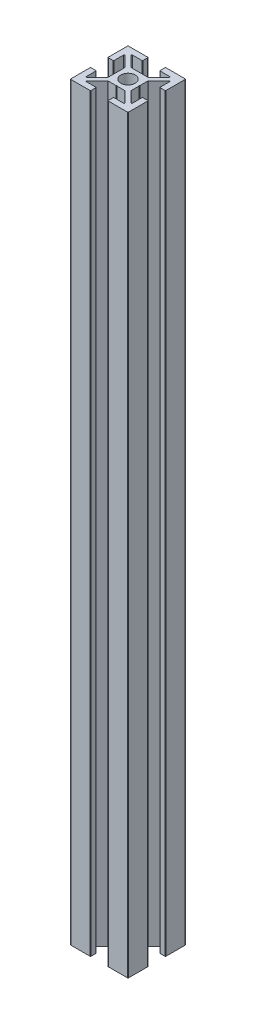
from build123d import *

# Parameters (mm, degrees)
SKETCH1_R           = 2.5
BOSS_EXTRUDE1_DEPTH = 260


with BuildPart() as part:
    # Sketch1 → Boss-Extrude1 (new body)
    with BuildSketch(Plane(origin=(0, 0, 0), x_dir=(1, 0, 0), z_dir=(0, 1, 0))):
        with BuildLine():
            Line((-2.997918472, 4.058578644), (-6.597918472, 7.658578644))
            ThreePointArc((-6.597918472, 7.658578644), (-6.621415508, 7.686854412), (-6.639339828, 7.718953455))
            ThreePointArc((-6.639339828, 7.718953455), (-6.656497116, 7.8), (-6.639339828, 7.881046545))
            ThreePointArc((-6.639339828, 7.881046545), (-6.565562901, 7.967644429), (-6.456497116, 8))
            Line((-6.456497116, 8), (-3.2, 8))
            ThreePointArc((-3.2, 8), (-3.058578644, 8.058578644), (-3, 8.2))
            Line((-3, 8.2), (-3, 9.8))
            ThreePointArc((-3, 9.8), (-3.058578644, 9.941421356), (-3.2, 10))
            Line((-3.2, 10), (-9.8, 10))
            ThreePointArc((-9.8, 10), (-9.941421356, 9.941421356), (-10, 9.8))
            Line((-10, 9.8), (-10, 3.2))
            ThreePointArc((-10, 3.2), (-9.941421356, 3.058578644), (-9.8, 3))
            Line((-9.8, 3), (-8.2, 3))
            ThreePointArc((-8.2, 3), (-8.058578644, 3.058578644), (-8, 3.2))
            Line((-8, 3.2), (-8, 6.456497116))
            ThreePointArc((-8, 6.456497116), (-7.967644429, 6.565562901), (-7.881046545, 6.639339828))
            ThreePointArc((-7.881046545, 6.639339828), (-7.8, 6.656497116), (-7.718953455, 6.639339828))
            ThreePointArc((-7.718953455, 6.639339828), (-7.686854412, 6.621415508), (-7.658578644, 6.597918472))
            Line((-7.658578644, 6.597918472), (-4.058578644, 2.997918472))
            ThreePointArc((-4.058578644, 2.997918472), (-4.015224093, 2.933033802), (-4, 2.856497116))
            Line((-4, 2.856497116), (-4, 0.130901699))
            ThreePointArc((-4, 0.130901699), (-3.99253254, 0.104615144), (-3.97236068, 0.08618034))
            Line((-3.97236068, 0.08618034), (-3.8, 0))
            Line((-3.8, 0), (-3.97236068, -0.08618034))
            ThreePointArc((-3.97236068, -0.08618034), (-3.99253254, -0.104615144), (-4, -0.130901699))
            Line((-4, -0.130901699), (-4, -2.856497116))
            ThreePointArc((-4, -2.856497116), (-4.015224093, -2.933033802), (-4.058578644, -2.997918472))
            Line((-4.058578644, -2.997918472), (-7.658578644, -6.597918472))
            ThreePointArc((-7.658578644, -6.597918472), (-7.686854412, -6.621415508), (-7.718953455, -6.639339828))
            ThreePointArc((-7.718953455, -6.639339828), (-7.8, -6.656497116), (-7.881046545, -6.639339828))
            ThreePointArc((-7.881046545, -6.639339828), (-7.967644429, -6.565562901), (-8, -6.456497116))
            Line((-8, -6.456497116), (-8, -3.2))
            ThreePointArc((-8, -3.2), (-8.058578644, -3.058578644), (-8.2, -3))
            Line((-8.2, -3), (-9.8, -3))
            ThreePointArc((-9.8, -3), (-9.941421356, -3.058578644), (-10, -3.2))
            Line((-10, -3.2), (-10, -9.8))
            ThreePointArc((-10, -9.8), (-9.941421356, -9.941421356), (-9.8, -10))
            Line((-9.8, -10), (-3.2, -10))
            ThreePointArc((-3.2, -10), (-3.058578644, -9.941421356), (-3, -9.8))
            Line((-3, -9.8), (-3, -8.2))
            ThreePointArc((-3, -8.2), (-3.058578644, -8.058578644), (-3.2, -8))
            Line((-3.2, -8), (-6.456497116, -8))
            ThreePointArc((-6.456497116, -8), (-6.565562901, -7.967644429), (-6.639339828, -7.881046545))
            ThreePointArc((-6.639339828, -7.881046545), (-6.656497116, -7.8), (-6.639339828, -7.718953455))
            ThreePointArc((-6.639339828, -7.718953455), (-6.621415508, -7.686854412), (-6.597918472, -7.658578644))
            Line((-6.597918472, -7.658578644), (-2.997918472, -4.058578644))
            ThreePointArc((-2.997918472, -4.058578644), (-2.933033802, -4.015224093), (-2.856497116, -4))
            Line((-2.856497116, -4), (-0.211803399, -4))
            ThreePointArc((-0.211803399, -4), (-0.200315753, -3.998662449), (-0.189442719, -3.99472136))
            Line((-0.189442719, -3.99472136), (0, -3.9))
            Line((0, -3.9), (0.189442719, -3.99472136))
            ThreePointArc((0.189442719, -3.99472136), (0.200315753, -3.998662449), (0.211803399, -4))
            Line((0.211803399, -4), (2.856497116, -4))
            ThreePointArc((2.856497116, -4), (2.933033802, -4.015224093), (2.997918472, -4.058578644))
            Line((2.997918472, -4.058578644), (6.597918472, -7.658578644))
            ThreePointArc((6.597918472, -7.658578644), (6.621415508, -7.686854412), (6.639339828, -7.718953455))
            ThreePointArc((6.639339828, -7.718953455), (6.656497116, -7.8), (6.639339828, -7.881046545))
            ThreePointArc((6.639339828, -7.881046545), (6.565562901, -7.967644429), (6.456497116, -8))
            Line((6.456497116, -8), (3.2, -8))
            ThreePointArc((3.2, -8), (3.058578644, -8.058578644), (3, -8.2))
            Line((3, -8.2), (3, -9.8))
            ThreePointArc((3, -9.8), (3.058578644, -9.941421356), (3.2, -10))
            Line((3.2, -10), (9.8, -10))
            ThreePointArc((9.8, -10), (9.941421356, -9.941421356), (10, -9.8))
            Line((10, -9.8), (10, -3.2))
            ThreePointArc((10, -3.2), (9.941421356, -3.058578644), (9.8, -3))
            Line((9.8, -3), (8.2, -3))
            ThreePointArc((8.2, -3), (8.058578644, -3.058578644), (8, -3.2))
            Line((8, -3.2), (8, -6.456497116))
            ThreePointArc((8, -6.456497116), (7.967644429, -6.565562901), (7.881046545, -6.639339828))
            ThreePointArc((7.881046545, -6.639339828), (7.8, -6.656497116), (7.718953455, -6.639339828))
            ThreePointArc((7.718953455, -6.639339828), (7.686854412, -6.621415508), (7.658578644, -6.597918472))
            Line((7.658578644, -6.597918472), (4.058578644, -2.997918472))
            ThreePointArc((4.058578644, -2.997918472), (4.015224093, -2.933033802), (4, -2.856497116))
            Line((4, -2.856497116), (4, -0.130901699))
            ThreePointArc((4, -0.130901699), (3.99253254, -0.104615144), (3.97236068, -0.08618034))
            Line((3.97236068, -0.08618034), (3.8, 0))
            Line((3.8, 0), (3.97236068, 0.08618034))
            ThreePointArc((3.97236068, 0.08618034), (3.99253254, 0.104615144), (4, 0.130901699))
            Line((4, 0.130901699), (4, 2.856497116))
            ThreePointArc((4, 2.856497116), (4.015224093, 2.933033802), (4.058578644, 2.997918472))
            Line((4.058578644, 2.997918472), (7.658578644, 6.597918472))
            ThreePointArc((7.658578644, 6.597918472), (7.686854412, 6.621415508), (7.718953455, 6.639339828))
            ThreePointArc((7.718953455, 6.639339828), (7.8, 6.656497116), (7.881046545, 6.639339828))
            ThreePointArc((7.881046545, 6.639339828), (7.967644429, 6.565562901), (8, 6.456497116))
            Line((8, 6.456497116), (8, 3.2))
            ThreePointArc((8, 3.2), (8.058578644, 3.058578644), (8.2, 3))
            Line((8.2, 3), (9.8, 3))
            ThreePointArc((9.8, 3), (9.941421356, 3.058578644), (10, 3.2))
            Line((10, 3.2), (10, 9.8))
            ThreePointArc((10, 9.8), (9.941421356, 9.941421356), (9.8, 10))
            Line((9.8, 10), (3.2, 10))
            ThreePointArc((3.2, 10), (3.058578644, 9.941421356), (3, 9.8))
            Line((3, 9.8), (3, 8.2))
            ThreePointArc((3, 8.2), (3.058578644, 8.058578644), (3.2, 8))
            Line((3.2, 8), (6.456497116, 8))
            ThreePointArc((6.456497116, 8), (6.565562901, 7.967644429), (6.639339828, 7.881046545))
            ThreePointArc((6.639339828, 7.881046545), (6.656497116, 7.8), (6.639339828, 7.718953455))
            ThreePointArc((6.639339828, 7.718953455), (6.621415508, 7.686854412), (6.597918472, 7.658578644))
            Line((6.597918472, 7.658578644), (2.997918472, 4.058578644))
            ThreePointArc((2.997918472, 4.058578644), (2.933033802, 4.015224093), (2.856497116, 4))
            Line((2.856497116, 4), (0.211803399, 4))
            ThreePointArc((0.211803399, 4), (0.200315753, 3.998662449), (0.189442719, 3.99472136))
            Line((0.189442719, 3.99472136), (0, 3.9))
            Line((0, 3.9), (-0.189442719, 3.99472136))
            ThreePointArc((-0.189442719, 3.99472136), (-0.200315753, 3.998662449), (-0.211803399, 4))
            Line((-0.211803399, 4), (-2.856497116, 4))
            ThreePointArc((-2.856497116, 4), (-2.933033802, 4.015224093), (-2.997918472, 4.058578644))
        make_face()
        Circle(SKETCH1_R, mode=Mode.SUBTRACT)
    extrude(amount=BOSS_EXTRUDE1_DEPTH)


solid = part.part
